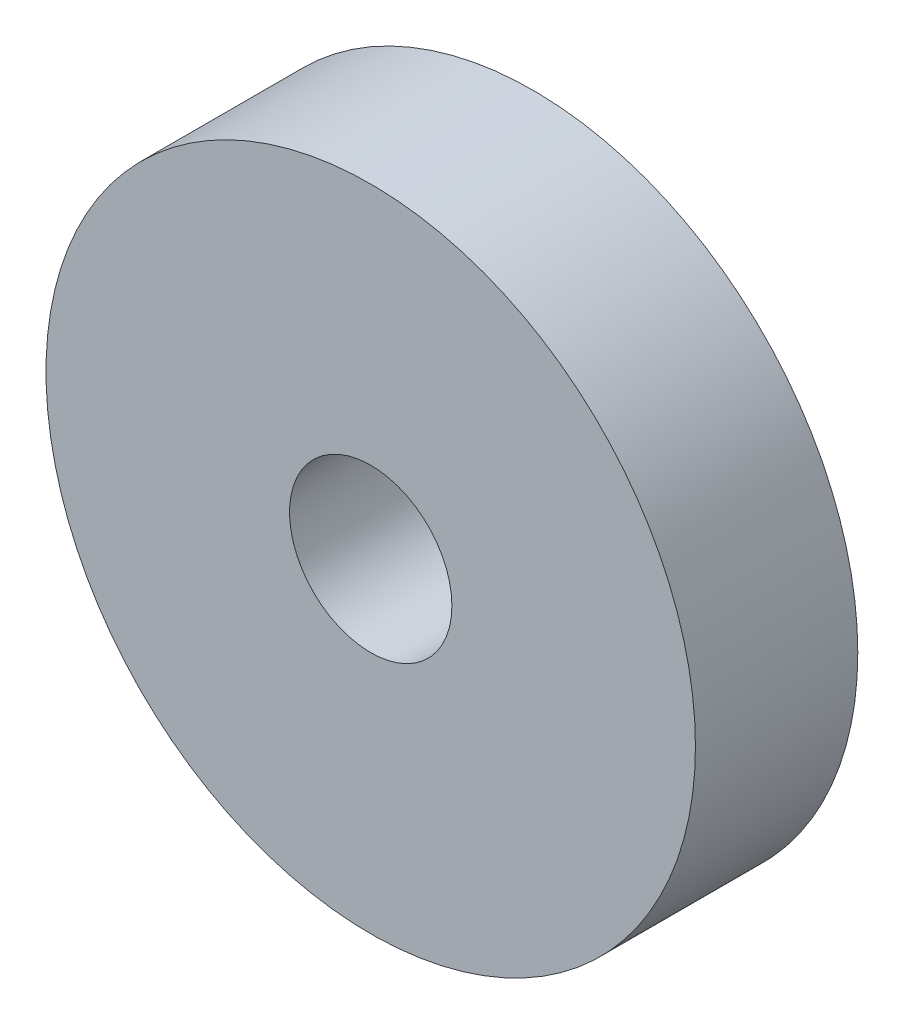
from build123d import *

# Parameters (mm, degrees)
SKETCH2_R           = 25.4
SKETCH2_R_2         = 6.35
BOSS_EXTRUDE2_DEPTH = 12.7


with BuildPart() as part:
    # Sketch2 → Boss-Extrude2 (new body)
    with BuildSketch(Plane.XY):
        Circle(SKETCH2_R)
        Circle(SKETCH2_R_2, mode=Mode.SUBTRACT)
    extrude(amount=BOSS_EXTRUDE2_DEPTH)


solid = part.part
